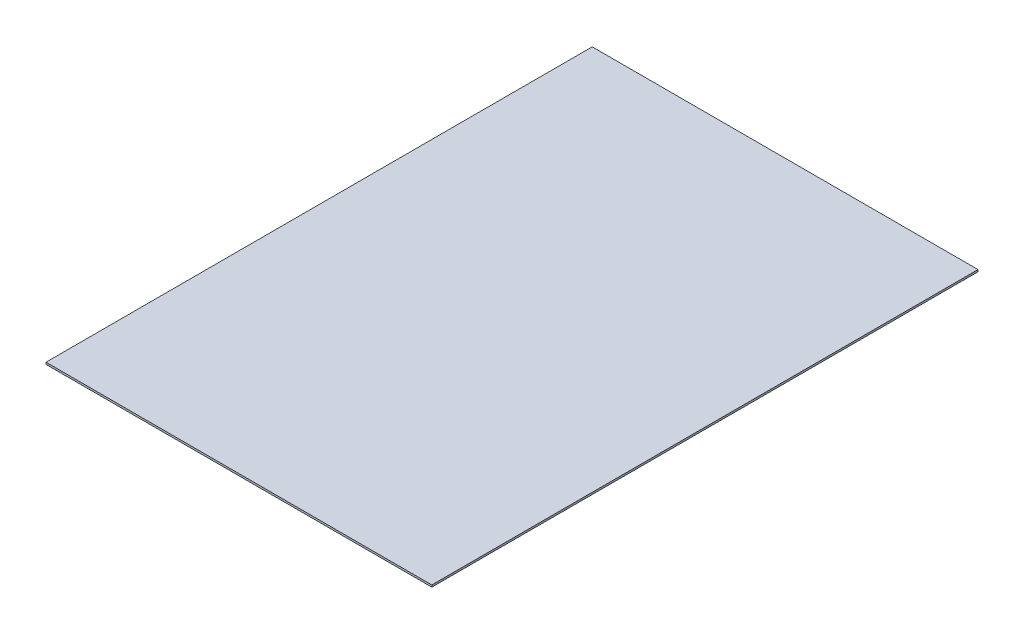
from build123d import *

# Parameters (mm, degrees)
SKETCH1_W           = 594
SKETCH1_H           = 841
BOSS_EXTRUDE1_DEPTH = 3


with BuildPart() as part:
    # Sketch1 → Boss-Extrude1 (new body)
    with BuildSketch(Plane(origin=(0, 0, 0), x_dir=(1, 0, 0), z_dir=(0, 1, 0))):
        Rectangle(SKETCH1_W, SKETCH1_H)
    extrude(amount=BOSS_EXTRUDE1_DEPTH)


solid = part.part
